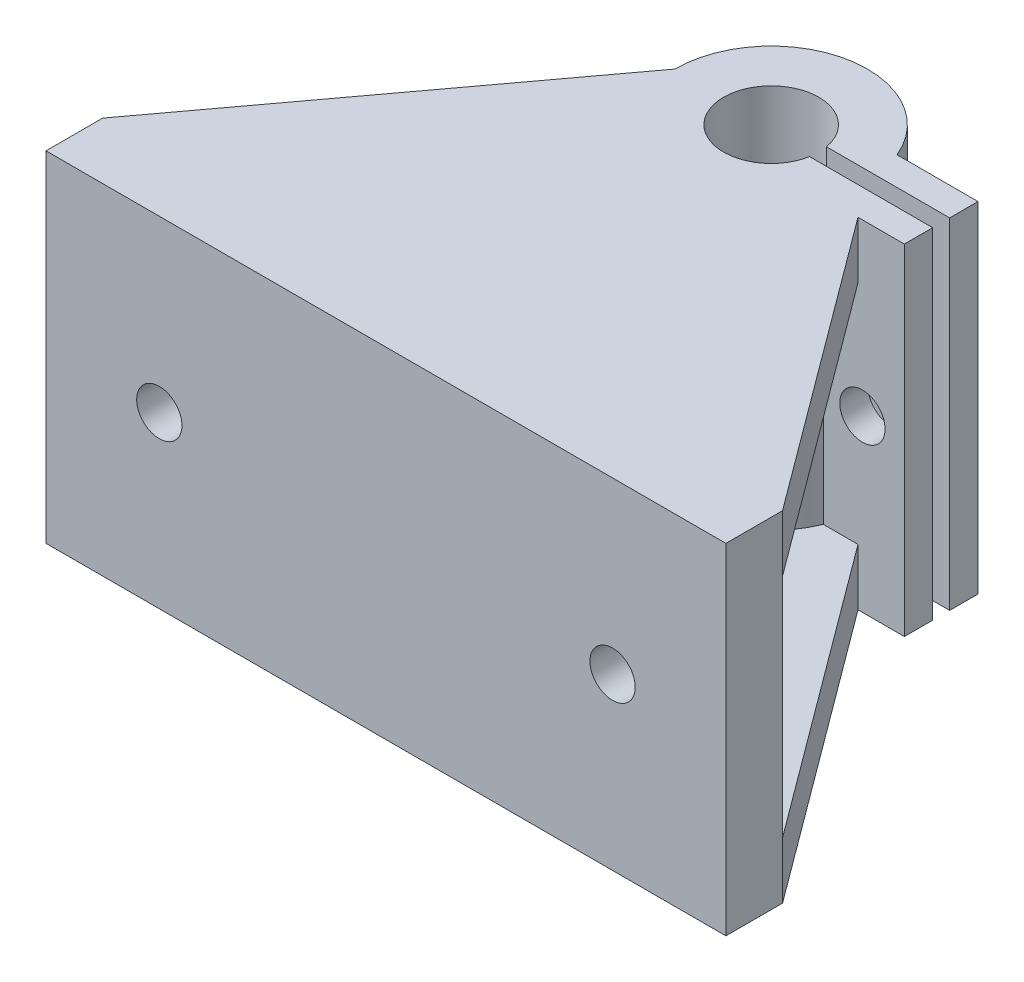
from build123d import *

# Parameters (mm, degrees)
SZKIC1_R                      = 8.5
SZKIC1_R_2                    = 4.2
DODANIE_WYCI_GNI_CIE1_DEPTH   = 30
SZKIC1_W                      = 60
SZKIC1_H                      = 5
DODANIE_WYCI_GNI_CIE1_2_DEPTH = 30
DODANIE_WYCI_GNI_CIE2_DEPTH   = 5
SZKIC3_W                      = 6
SZKIC3_H                      = 22
DODANIE_WYCI_GNI_CIE3_DEPTH   = 26
DODANIE_WYCI_GNI_CIE4_DEPTH   = 5
WYTNIJ_WYCI_GNI_CIE1_REACH    = 62.052
SZKIC5_R                      = 2
WYTNIJ_WYCI_GNI_CIE2_REACH    = 62.052
SZKIC6_W                      = 10.270986067
SZKIC6_H                      = 1.5
SZKIC7_W                      = 9.24961725
SZKIC7_H                      = 2.5
DODANIE_WYCI_GNI_CIE5_DEPTH   = 30
SZKIC8_R                      = 2
WYTNIJ_WYCI_GNI_CIE3_DEPTH    = 30


with BuildPart() as part:
    # Szkic1 → Dodanie-wyciągnięcie1 (new body)
    with BuildSketch(Plane(origin=(0, 0, 0), x_dir=(1, 0, 0), z_dir=(0, 1, 0))):
        with Locations(Location((0, 34, 0), (0, 0, 270))):
            Circle(SZKIC1_R)
        with Locations(Location((0, 34, 0), (0, 0, 270))):
            Circle(SZKIC1_R_2, mode=Mode.SUBTRACT)
    extrude(amount=DODANIE_WYCI_GNI_CIE1_DEPTH)



with BuildPart() as body_2:
    # Szkic1 → Dodanie-wyci_gni_cie1 2 (new body)
    with BuildSketch(Plane(origin=(0, 0, 0), x_dir=(1, 0, 0), z_dir=(0, 1, 0))):
        with Locations((0, 2.5)):
            Rectangle(SZKIC1_W, SZKIC1_H)
    extrude(amount=DODANIE_WYCI_GNI_CIE1_2_DEPTH)


with BuildPart() as part_1:
    add(part.part)

    add(body_2.part)  # Dodanie-wyciągnięcie2 merges body 2
    # Szkic2 → Dodanie-wyciągnięcie2 (add)
    with BuildSketch(Plane.XZ):
        Polygon((30, -5), (8.5, -34), (0, -25.5), (-8.5, -34), (-30, -5), align=None)
    extrude(amount=-DODANIE_WYCI_GNI_CIE2_DEPTH)

    # Szkic3 → Dodanie-wyciągnięcie3 (add)
    with BuildSketch(Plane(origin=(0, 30, 0), x_dir=(1, 0, 0), z_dir=(0, 1, 0))):
        with Locations((0, 16)):
            Rectangle(SZKIC3_W, SZKIC3_H)
    extrude(amount=-DODANIE_WYCI_GNI_CIE3_DEPTH)

    # Szkic4 → Dodanie-wyciągnięcie4 (add)
    with BuildSketch(Plane(origin=(0, 30, 0), x_dir=(1, 0, 0), z_dir=(0, 1, 0))):
        Polygon((0, 26.824162036), (8.5, 34), (30, 5), (-30, 5), (-8.5, 34), align=None)
    extrude(amount=-DODANIE_WYCI_GNI_CIE4_DEPTH)

    # Szkic5 → Wytnij-wyciągnięcie1 (cut, up to next)
    with BuildSketch(Plane.XY, mode=Mode.PRIVATE) as wytnij_wyci_gni_cie1_sk1:
        with Locations((-20, 15)):
            Circle(SZKIC5_R)
    wytnij_wyci_gni_cie1_tool1 = extrude(wytnij_wyci_gni_cie1_sk1.sketch, amount=-WYTNIJ_WYCI_GNI_CIE1_REACH, mode=Mode.PRIVATE) & part_1.part
    # Szkic5 → Wytnij-wyciągnięcie1 (cut, up to next)
    with BuildSketch(Plane.XY, mode=Mode.PRIVATE) as wytnij_wyci_gni_cie1_sk2:
        with Locations((20, 15)):
            Circle(SZKIC5_R)
    wytnij_wyci_gni_cie1_tool2 = extrude(wytnij_wyci_gni_cie1_sk2.sketch, amount=-WYTNIJ_WYCI_GNI_CIE1_REACH, mode=Mode.PRIVATE) & part_1.part
    add(wytnij_wyci_gni_cie1_tool1.solids().sort_by_distance((-20, 15, 0))[0], mode=Mode.SUBTRACT)
    add(wytnij_wyci_gni_cie1_tool2.solids().sort_by_distance((20, 15, 0))[0], mode=Mode.SUBTRACT)

    # Szkic6 → Wytnij-wyciągnięcie2 (cut, up to next)
    with BuildSketch(Plane(origin=(0, 30, 0), x_dir=(1, 0, 0), z_dir=(0, 1, 0)), mode=Mode.PRIVATE) as wytnij_wyci_gni_cie2_sk1:
        with Locations((5.135493034, 34)):
            Rectangle(SZKIC6_W, SZKIC6_H)
    wytnij_wyci_gni_cie2_tool1 = extrude(wytnij_wyci_gni_cie2_sk1.sketch, amount=-WYTNIJ_WYCI_GNI_CIE2_REACH, mode=Mode.PRIVATE) & part_1.part
    add(wytnij_wyci_gni_cie2_tool1.solids().sort_by_distance((5.135493, 30, -34))[0], mode=Mode.SUBTRACT)

    # Szkic7 → Dodanie-wyciągnięcie5 (add)
    with BuildSketch(Plane(origin=(0, 30, 0), x_dir=(1, 0, 0), z_dir=(0, 1, 0))):
        with Locations((10.375191375, 32)):
            Rectangle(SZKIC7_W, SZKIC7_H)
        with Locations((10.375191375, 36)):
            Rectangle(SZKIC7_W, SZKIC7_H)
    extrude(amount=-DODANIE_WYCI_GNI_CIE5_DEPTH)

    # Szkic8 → Wytnij-wyciągnięcie3 (cut)
    with BuildSketch(Plane(origin=(0, 0, -37.25), x_dir=(-1, 0, 0), z_dir=(0, 0, -1))):
        with Locations((-11.3, 15)):
            Circle(SZKIC8_R)
    extrude(amount=-WYTNIJ_WYCI_GNI_CIE3_DEPTH, mode=Mode.SUBTRACT)


solid = part_1.part
